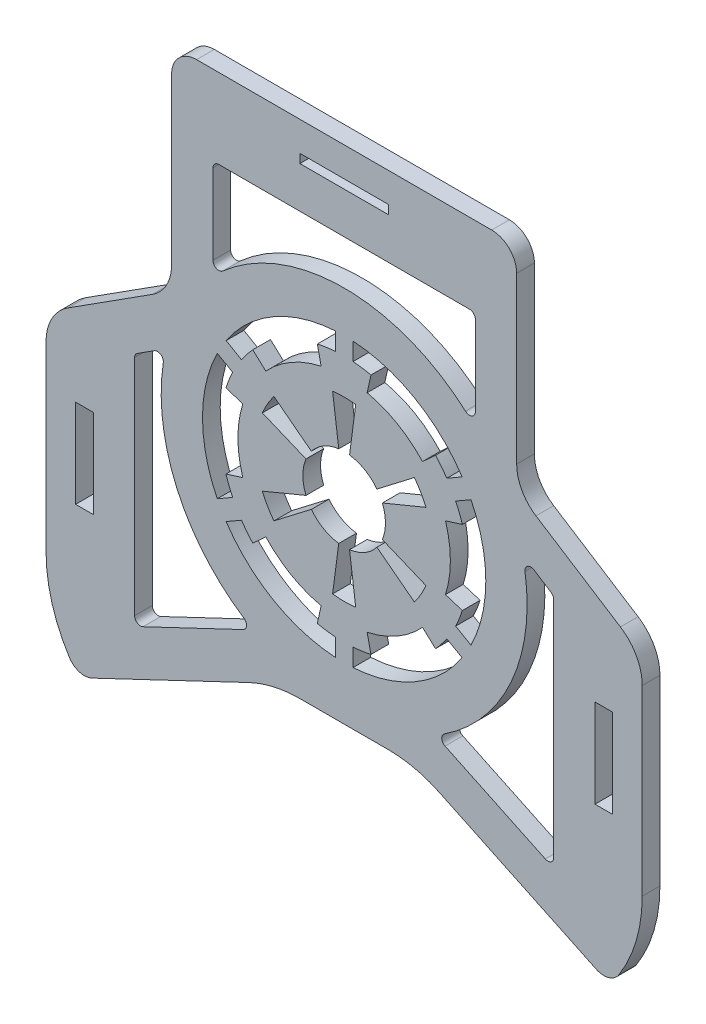
from build123d import *

# Parameters (mm, degrees)
SKETCH2_W           = 3
SKETCH2_H           = 15
SKETCH2_W_2         = 15
SKETCH2_H_2         = 1.5
BOSS_EXTRUDE1_DEPTH = 3
CUT_EXTRUDE1_DEPTH  = 128.45356017
FILLET1_R           = 3
FILLET2_R           = 20
FILLET3_R           = 8
SKETCH5_R           = 7
CUT_EXTRUDE2_DEPTH  = 128.45356017
CUT_EXTRUDE3_DEPTH  = 128.45356017
FILLET4_R           = 1


with BuildPart() as part:
    # Sketch2 → Boss-Extrude1 (new body)
    with BuildSketch(Plane.XY):
        with BuildLine():
            Line((93, 2.1), (93, 62.1))
            ThreePointArc((93, 62.1), (85.67766953, 79.77766953), (68, 87.1))
            Line((68, 87.1), (17, 87.1))
            ThreePointArc((17, 87.1), (-0.67766953, 79.77766953), (-8, 62.1))
            Line((-8, 62.1), (-8, 2.1))
            ThreePointArc((-8, 2.1), (-0.67766953, -15.57766953), (17, -22.9))
            Line((17, -22.9), (68, -22.9))
            ThreePointArc((68, -22.9), (85.67766953, -15.57766953), (93, 2.1))
        make_face()
        with Locations((-1.5, 19.1)):
            Rectangle(SKETCH2_W, SKETCH2_H, mode=Mode.SUBTRACT)
        with Locations((86.5, 19.1)):
            Rectangle(SKETCH2_W, SKETCH2_H, mode=Mode.SUBTRACT)
        with Locations((42.5, 81.35)):
            Rectangle(SKETCH2_W_2, SKETCH2_H_2, mode=Mode.SUBTRACT)
    extrude(amount=BOSS_EXTRUDE1_DEPTH)

    # Sketch3 → Cut-Extrude1 (cut, through all)
    with BuildSketch(Plane.XY.offset(3)):
        with BuildLine():
            Line((13.267805899, 82.867805899), (13.267805899, 54.867805899))
            ThreePointArc((13.267805899, 54.867805899), (12.397322327, 51.467236981), (10, 48.903166724))
            Line((10, 48.903166724), (-8, 37.406474337))
            Line((-8, 37.406474337), (-8, 106.022950617))
            Line((-8, 106.022950617), (93, 106.022950617))
            Line((93, 106.022950617), (93, 37.406474337))
            Line((93, 37.406474337), (75, 48.903166724))
            ThreePointArc((75, 48.903166724), (72.602677673, 51.467236981), (71.732194101, 54.867805899))
            Line((71.732194101, 54.867805899), (71.732194101, 82.867805899))
            ThreePointArc((71.732194101, 82.867805899), (70.492613148, 85.860419047), (67.5, 87.1))
            Line((67.5, 87.1), (17.5, 87.1))
            ThreePointArc((17.5, 87.1), (14.507386852, 85.860419047), (13.267805899, 82.867805899))
        make_face()
        Polygon((-2.473837178, -13.577042628), (30.5, 2.1), (54.5, 2.1), (87.473837178, -13.577042628), (87.473837178, -35.532818411), (-2.473837178, -35.532818411), align=None)
    extrude(amount=-CUT_EXTRUDE1_DEPTH, mode=Mode.SUBTRACT)

    # Fillet1
    fillet1_edges = [part.edges().sort_by_distance(p)[0] for p in [
        (-2.473837178, -13.577042628, 1.5),
        (87.473837178, -13.577042628, 1.5),
    ]]
    fillet(fillet1_edges, radius=FILLET1_R)

    # Fillet2
    fillet2_edges = [part.edges().sort_by_distance(p)[0] for p in [
        (30.5, 2.1, 1.5),
        (54.5, 2.1, 1.5),
    ]]
    fillet(fillet2_edges, radius=FILLET2_R)

    # Fillet3
    fillet3_edges = [part.edges().sort_by_distance(p)[0] for p in [
        (-8, 37.406474337, 1.5),
        (93, 37.406474337, 1.5),
    ]]
    fillet(fillet3_edges, radius=FILLET3_R)

    # Sketch5 → Cut-Extrude2 (cut, through all)
    with BuildSketch(Plane.XY.offset(3)):
        with BuildLine():
            Line((41, 56.046360066), (41, 59.053079134))
            ThreePointArc((41, 59.053079134), (30.5, 55.884609691), (22.506024971, 48.375577673))
            Line((22.506024971, 48.375577673), (25.109920066, 46.872218139))
            ThreePointArc((25.109920066, 46.872218139), (26.019246877, 48.114790682), (27.017175927, 49.28739436))
            ThreePointArc((27.017175927, 49.28739436), (32, 53.286533479), (37.954768107, 55.60221615))
            ThreePointArc((37.954768107, 55.60221615), (39.469237206, 55.880146219), (41, 56.046360066))
        make_face()
        with BuildLine():
            Line((23.609920066, 44.274141927), (21.006024971, 45.777501461))
            ThreePointArc((21.006024971, 45.777501461), (18.5, 35.1), (21.006024971, 24.422498539))
            Line((21.006024971, 24.422498539), (23.609920066, 25.925858073))
            ThreePointArc((23.609920066, 25.925858073), (22.988484083, 27.334644463), (22.471944034, 28.78517821))
            ThreePointArc((22.471944034, 28.78517821), (21.5, 35.1), (22.471944034, 41.41482179))
            ThreePointArc((22.471944034, 41.41482179), (22.988484083, 42.865355537), (23.609920066, 44.274141927))
        make_face()
        with BuildLine():
            Line((25.109920066, 23.327781861), (22.506024971, 21.824422327))
            ThreePointArc((22.506024971, 21.824422327), (30.5, 14.315390309), (41, 11.146920866))
            Line((41, 11.146920866), (41, 14.153639934))
            ThreePointArc((41, 14.153639934), (39.469237206, 14.319853781), (37.954768107, 14.59778385))
            ThreePointArc((37.954768107, 14.59778385), (32, 16.913466521), (27.017175927, 20.91260564))
            ThreePointArc((27.017175927, 20.91260564), (26.019246877, 22.085209318), (25.109920066, 23.327781861))
        make_face()
        with BuildLine():
            ThreePointArc((44, 11.146920866), (54.5, 14.315390309), (62.493975029, 21.824422327))
            Line((62.493975029, 21.824422327), (59.890079934, 23.327781861))
            ThreePointArc((59.890079934, 23.327781861), (58.980753123, 22.085209318), (57.982824073, 20.91260564))
            ThreePointArc((57.982824073, 20.91260564), (53, 16.913466521), (47.045231893, 14.59778385))
            ThreePointArc((47.045231893, 14.59778385), (45.530762794, 14.319853781), (44, 14.153639934))
            Line((44, 14.153639934), (44, 11.146920866))
        make_face()
        with BuildLine():
            ThreePointArc((66.5, 35.1), (65.86509577, 40.583821628), (63.993975029, 45.777501461))
            Line((63.993975029, 45.777501461), (61.390079934, 44.274141927))
            ThreePointArc((61.390079934, 44.274141927), (62.011515917, 42.865355537), (62.528055966, 41.41482179))
            ThreePointArc((62.528055966, 41.41482179), (63.25559172, 38.29459111), (63.5, 35.1))
            ThreePointArc((63.5, 35.1), (63.25559172, 31.90540889), (62.528055966, 28.78517821))
            ThreePointArc((62.528055966, 28.78517821), (62.011515917, 27.334644463), (61.390079934, 25.925858073))
            Line((61.390079934, 25.925858073), (63.993975029, 24.422498539))
            ThreePointArc((63.993975029, 24.422498539), (65.86509577, 29.616178372), (66.5, 35.1))
        make_face()
        with BuildLine():
            ThreePointArc((62.493975029, 48.375577673), (54.5, 55.884609691), (44, 59.053079134))
            Line((44, 59.053079134), (44, 56.046360066))
            ThreePointArc((44, 56.046360066), (45.530762794, 55.880146219), (47.045231893, 55.60221615))
            ThreePointArc((47.045231893, 55.60221615), (53, 53.286533479), (57.982824073, 49.28739436))
            ThreePointArc((57.982824073, 49.28739436), (58.980753123, 48.114790682), (59.890079934, 46.872218139))
            Line((59.890079934, 46.872218139), (62.493975029, 48.375577673))
        make_face()
        with BuildLine():
            Line((38.604086949, 52.673328128), (37.954768107, 55.60221615))
            ThreePointArc((37.954768107, 55.60221615), (32, 53.286533479), (27.017175927, 49.28739436))
            Line((27.017175927, 49.28739436), (29.229007937, 47.260623737))
            ThreePointArc((29.229007937, 47.260623737), (33.5, 50.688457268), (38.604086949, 52.673328128))
        make_face()
        with BuildLine():
            Line((25.333094887, 40.512704391), (22.471944034, 41.41482179))
            ThreePointArc((22.471944034, 41.41482179), (21.5, 35.1), (22.471944034, 28.78517821))
            Line((22.471944034, 28.78517821), (25.333094887, 29.687295609))
            ThreePointArc((25.333094887, 29.687295609), (24.5, 35.1), (25.333094887, 40.512704391))
        make_face()
        with BuildLine():
            Line((29.229007937, 22.939376263), (27.017175927, 20.91260564))
            ThreePointArc((27.017175927, 20.91260564), (32, 16.913466521), (37.954768107, 14.59778385))
            Line((37.954768107, 14.59778385), (38.604086949, 17.526671872))
            ThreePointArc((38.604086949, 17.526671872), (33.5, 19.511542732), (29.229007937, 22.939376263))
        make_face()
        with BuildLine():
            ThreePointArc((47.045231893, 14.59778385), (53, 16.913466521), (57.982824073, 20.91260564))
            Line((57.982824073, 20.91260564), (55.770992063, 22.939376263))
            ThreePointArc((55.770992063, 22.939376263), (51.5, 19.511542732), (46.395913051, 17.526671872))
            Line((46.395913051, 17.526671872), (47.045231893, 14.59778385))
        make_face()
        with BuildLine():
            ThreePointArc((63.5, 35.1), (63.25559172, 38.29459111), (62.528055966, 41.41482179))
            Line((62.528055966, 41.41482179), (59.666905113, 40.512704391))
            ThreePointArc((59.666905113, 40.512704391), (60.290507188, 37.838220951), (60.5, 35.1))
            ThreePointArc((60.5, 35.1), (60.290507188, 32.361779049), (59.666905113, 29.687295609))
            Line((59.666905113, 29.687295609), (62.528055966, 28.78517821))
            ThreePointArc((62.528055966, 28.78517821), (63.25559172, 31.90540889), (63.5, 35.1))
        make_face()
        with BuildLine():
            ThreePointArc((57.982824073, 49.28739436), (53, 53.286533479), (47.045231893, 55.60221615))
            Line((47.045231893, 55.60221615), (46.395913051, 52.673328128))
            ThreePointArc((46.395913051, 52.673328128), (51.5, 50.688457268), (55.770992063, 47.260623737))
            Line((55.770992063, 47.260623737), (57.982824073, 49.28739436))
        make_face()
        with BuildLine():
            Line((36.946526618, 39.361330003), (30.599699896, 44.231421435))
            ThreePointArc((30.599699896, 44.231421435), (29.509618943, 42.6), (28.641807012, 40.840251485))
            Line((28.641807012, 40.840251485), (36.032843272, 37.778784027))
            ThreePointArc((36.032843272, 37.778784027), (36.437822174, 38.6), (36.946526618, 39.361330003))
        make_face()
        with BuildLine():
            Line((36.032843272, 32.421215973), (28.641807012, 29.359748515))
            ThreePointArc((28.641807012, 29.359748515), (29.509618943, 27.6), (30.599699896, 25.968578565))
            Line((30.599699896, 25.968578565), (36.946526618, 30.838669997))
            ThreePointArc((36.946526618, 30.838669997), (36.437822174, 31.6), (36.032843272, 32.421215973))
        make_face()
        with BuildLine():
            ThreePointArc((56.358192988, 40.840251485), (55.490381057, 42.6), (54.400300104, 44.231421435))
            Line((54.400300104, 44.231421435), (48.053473382, 39.361330003))
            ThreePointArc((48.053473382, 39.361330003), (48.562177826, 38.6), (48.967156728, 37.778784027))
            Line((48.967156728, 37.778784027), (56.358192988, 40.840251485))
        make_face()
        with BuildLine():
            ThreePointArc((54.400300104, 25.968578565), (55.490381057, 27.6), (56.358192988, 29.359748515))
            Line((56.358192988, 29.359748515), (48.967156728, 32.421215973))
            ThreePointArc((48.967156728, 32.421215973), (48.562177826, 31.6), (48.053473382, 30.838669997))
            Line((48.053473382, 30.838669997), (54.400300104, 25.968578565))
        make_face()
        with BuildLine():
            ThreePointArc((40.542107117, 20.228327079), (42.5, 20.1), (44.457892883, 20.228327079))
            Line((44.457892883, 20.228327079), (43.413683346, 28.15988597))
            ThreePointArc((43.413683346, 28.15988597), (42.5, 28.1), (41.586316654, 28.15988597))
            Line((41.586316654, 28.15988597), (40.542107117, 20.228327079))
        make_face()
        with BuildLine():
            Line((43.413683346, 42.04011403), (44.457892883, 49.971672921))
            ThreePointArc((44.457892883, 49.971672921), (42.5, 50.1), (40.542107117, 49.971672921))
            Line((40.542107117, 49.971672921), (41.586316654, 42.04011403))
            ThreePointArc((41.586316654, 42.04011403), (42.5, 42.1), (43.413683346, 42.04011403))
        make_face()
        with Locations((42.5, 35.1)):
            Circle(SKETCH5_R)
    extrude(amount=-CUT_EXTRUDE2_DEPTH, mode=Mode.SUBTRACT)

    # Sketch6 → Cut-Extrude3 (cut, through all)
    with BuildSketch(Plane.XY.offset(3)):
        with BuildLine():
            Line((20.267805899, 73.6), (20.267805899, 56.703924307))
            ThreePointArc((20.267805899, 56.703924307), (30.43189438, 63.654523753), (42.5, 66.1))
            ThreePointArc((42.5, 66.1), (54.56810562, 63.654523753), (64.732194101, 56.703924307))
            Line((64.732194101, 56.703924307), (64.732194101, 73.6))
            Line((64.732194101, 73.6), (20.267805899, 73.6))
        make_face()
        with BuildLine():
            Line((7, 38.681073475), (7, -1.321937625))
            Line((7, -1.321937625), (27.063139268, 8.216857871))
            ThreePointArc((27.063139268, 8.216857871), (21.378843495, 12.408663594), (16.790879782, 17.778304424))
            ThreePointArc((16.790879782, 17.778304424), (12.018818863, 29.452204281), (12.291615553, 42.060855488))
            Line((12.291615553, 42.060855488), (7, 38.681073475))
        make_face()
        with BuildLine():
            Line((78, 38.681073475), (72.708384447, 42.060855488))
            ThreePointArc((72.708384447, 42.060855488), (72.981181137, 29.452204281), (68.209120218, 17.778304424))
            ThreePointArc((68.209120218, 17.778304424), (63.621156505, 12.408663594), (57.936860732, 8.216857871))
            Line((57.936860732, 8.216857871), (78, -1.321937625))
            Line((78, -1.321937625), (78, 38.681073475))
        make_face()
    extrude(amount=-CUT_EXTRUDE3_DEPTH, mode=Mode.SUBTRACT)

    # Fillet4
    fillet4_edges = [part.edges().sort_by_distance(p)[0] for p in [
        (20.267805899, 73.6, 1.5),
        (64.732194101, 73.6, 1.5),
        (64.732194101, 56.703924307, 1.5),
        (20.267805899, 56.703924307, 1.5),
        (7, 38.681073475, 1.5),
        (12.291615553, 42.060855488, 1.5),
        (27.063139268, 8.216857871, 1.5),
        (7, -1.321937625, 1.5),
        (72.708384447, 42.060855488, 1.5),
        (78, 38.681073475, 1.5),
        (78, -1.321937625, 1.5),
        (57.936860732, 8.216857871, 1.5),
    ]]
    fillet(fillet4_edges, radius=FILLET4_R)


solid = part.part
